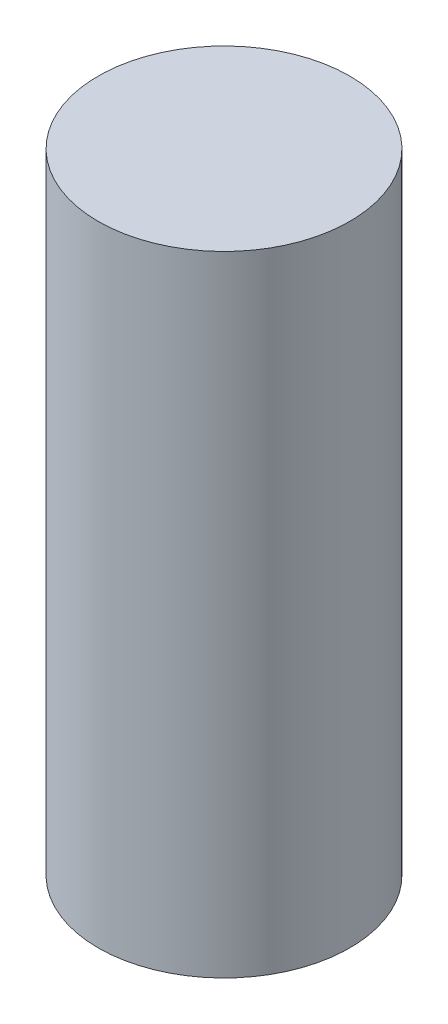
from build123d import *

# Parameters (mm, degrees)
SKETCH1_R           = 20
BOSS_EXTRUDE1_DEPTH = 100


with BuildPart() as part:
    # Sketch1 → Boss-Extrude1 (new body)
    with BuildSketch(Plane(origin=(0, 0, 0), x_dir=(1, 0, 0), z_dir=(0, 1, 0))):
        Circle(SKETCH1_R)
    extrude(amount=BOSS_EXTRUDE1_DEPTH)


solid = part.part
